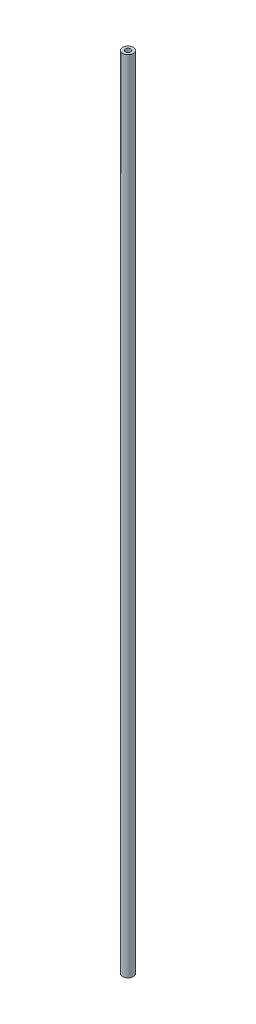
from build123d import *

# Parameters (mm, degrees)
SKETCH_1_R      = 1
SKETCH_1_R_2    = 0.5
EXTRUDE_1_DEPTH = 150


with BuildPart() as part:
    # 草图1 → 凸台-拉伸1 (new body)
    with BuildSketch(Plane(origin=(0, 0, 0), x_dir=(1, 0, 0), z_dir=(0, 1, 0))):
        with Locations(Location((0, 0, 0), (0, 0, 270))):
            Circle(SKETCH_1_R)
        with Locations(Location((0, 0, 0), (0, 0, 270))):
            Circle(SKETCH_1_R_2, mode=Mode.SUBTRACT)
    extrude(amount=EXTRUDE_1_DEPTH)


solid = part.part
